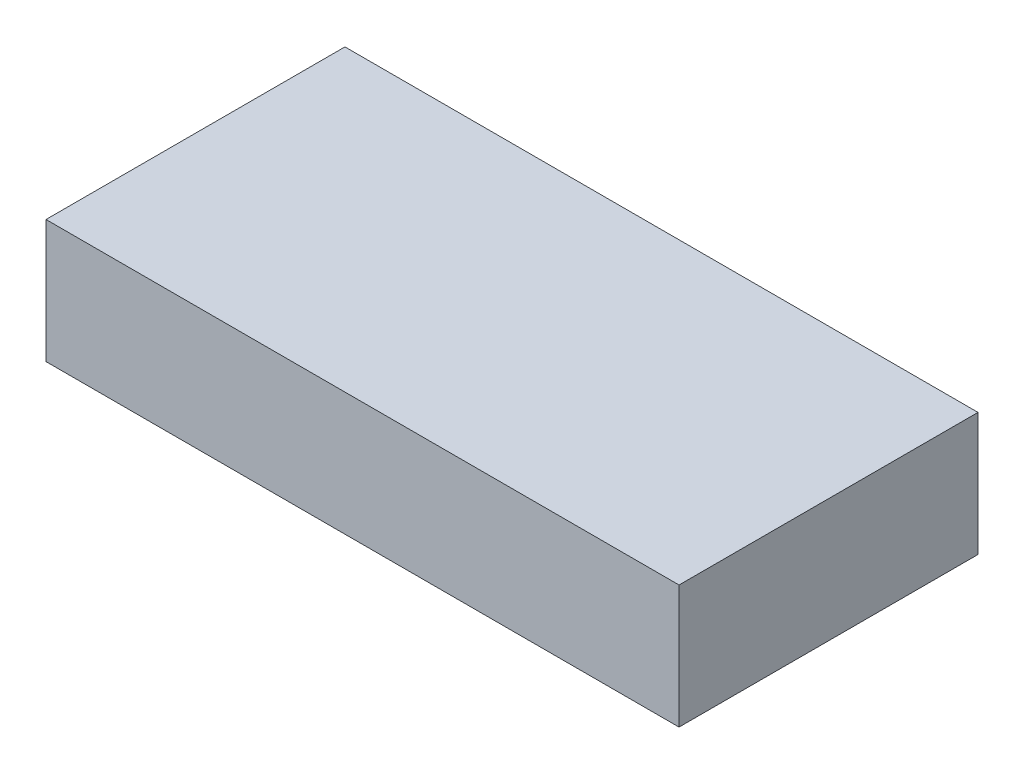
from build123d import *

# Parameters (mm, degrees)
SKETCH1_W           = 72
SKETCH1_H           = 34
BOSS_EXTRUDE1_DEPTH = 14


with BuildPart() as part:
    # Sketch1 → Boss-Extrude1 (new body)
    with BuildSketch(Plane(origin=(0, 0, 0), x_dir=(1, 0, 0), z_dir=(0, 1, 0))):
        with Locations((36, 17)):
            Rectangle(SKETCH1_W, SKETCH1_H)
    extrude(amount=BOSS_EXTRUDE1_DEPTH)


solid = part.part
